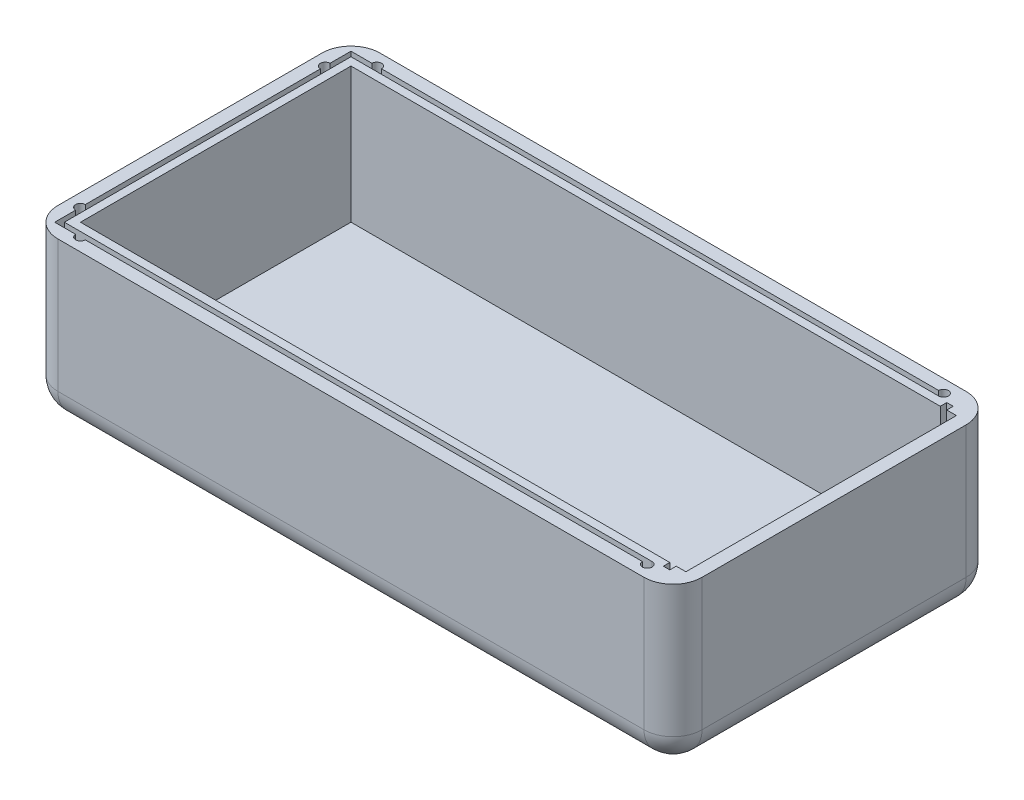
from build123d import *

# Parameters (mm, degrees)
SKETCH_1_W           = 100
SKETCH_1_H           = 50
EXTRUDE_1_DEPTH      = 25
SHELL_1_T            = -4
FILLET_1_R           = 4.5
SKETCH_2_R           = 0.75
CUT_EXTRUDE_1_DEPTH  = 5
CUT_EXTRUDE_3_DEPTH  = 2.5
SKETCH_8_W           = 36
SKETCH_8_H           = 12
CUT_EXTRUDE_4_DEPTH  = 3
SKETCH_9_W           = 42
SKETCH_9_H           = 21
CUT_EXTRUDE_7_DEPTH  = 2
SKETCH_7_W           = 1
SKETCH_7_H           = 42
CUT_EXTRUDE_8_DEPTH  = 1
SKETCH_11_W          = 1
SKETCH_11_H          = 21
CUT_EXTRUDE_10_DEPTH = 1
SKETCH_12_W          = 1
SKETCH_12_H          = 21
CUT_EXTRUDE_11_DEPTH = 1


with BuildPart() as part:
    # Эскиз1 → Бобышка-Вытянуть1 (new body)
    with BuildSketch(Plane(origin=(0, 0, 0), x_dir=(1, 0, 0), z_dir=(0, 1, 0))):
        with Locations((50, -25)):
            Rectangle(SKETCH_1_W, SKETCH_1_H)
    extrude(amount=EXTRUDE_1_DEPTH)

    # Оболочка1
    shell_1_openings = [part.faces().sort_by_distance(p)[0] for p in [
        (50, 25, 25),
    ]]
    offset(amount=SHELL_1_T, openings=shell_1_openings, kind=Kind.INTERSECTION)

    # Скругление1
    fillet_1_edges = [part.edges().sort_by_distance(p)[0] for p in [
        (50, 0, 50),
        (100, 0, 25),
        (50, 0, 0),
        (0, 0, 25),
        (100, 12.5, 0),
        (100, 12.5, 50),
        (0, 12.5, 0),
        (0, 12.5, 50),
    ]]
    fillet(fillet_1_edges, radius=FILLET_1_R)

    # Эскиз2 → Вырез-Вытянуть1 (cut)
    with BuildSketch(Plane(origin=(0, 25, 0), x_dir=(1, 0, 0), z_dir=(0, 1, 0))):
        with BuildLine():
            Line((2, -2), (2, -5.25))
            ThreePointArc((2, -5.25), (1.469669914, -6.530330086), (2.75, -6))
            Line((2.75, -6), (2.75, -2.75))
            Line((2.75, -2.75), (6, -2.75))
            ThreePointArc((6, -2.75), (6.530330086, -1.469669914), (5.25, -2))
            Line((5.25, -2), (2, -2))
        make_face()
        with BuildLine():
            Line((2, -44.75), (2, -48))
            Line((2, -48), (5.25, -48))
            ThreePointArc((5.25, -48), (6.530330086, -48.530330086), (6, -47.25))
            Line((6, -47.25), (2.75, -47.25))
            Line((2.75, -47.25), (2.75, -44))
            ThreePointArc((2.75, -44), (1.469669914, -43.469669914), (2, -44.75))
        make_face()
        with Locations((94, -2)):
            Circle(SKETCH_2_R)
        with Locations((94, -48)):
            Circle(SKETCH_2_R)
    extrude(amount=-CUT_EXTRUDE_1_DEPTH, mode=Mode.SUBTRACT)

    # Эскиз2<6> → Вырез-Вытянуть3 (cut)
    with BuildSketch(Plane(origin=(0, 25, 0), x_dir=(1, 0, 0), z_dir=(0, 1, 0))):
        with BuildLine():
            Line((2.75, -44), (2.75, -6))
            ThreePointArc((2.75, -6), (2.530330086, -6.530330086), (2, -6.75))
            Line((2, -6.75), (2, -43.25))
            ThreePointArc((2, -43.25), (2.530330086, -43.469669914), (2.75, -44))
        make_face()
        with BuildLine():
            ThreePointArc((6.75, -2), (6.530330086, -2.530330086), (6, -2.75))
            Line((6, -2.75), (94, -2.75))
            ThreePointArc((94, -2.75), (93.469669914, -2.530330086), (93.25, -2))
            Line((93.25, -2), (6.75, -2))
        make_face()
        with BuildLine():
            Line((94, -47.25), (6, -47.25))
            ThreePointArc((6, -47.25), (6.530330086, -47.469669914), (6.75, -48))
            Line((6.75, -48), (93.25, -48))
            ThreePointArc((93.25, -48), (93.469669914, -47.469669914), (94, -47.25))
        make_face()
    extrude(amount=-CUT_EXTRUDE_3_DEPTH, mode=Mode.SUBTRACT)

    # Эскиз8 → Вырез-Вытянуть4 (cut)
    with BuildSketch(Plane.ZY.offset(-96)):
        with Locations((25, 14.5)):
            Rectangle(SKETCH_8_W, SKETCH_8_H)
    extrude(amount=-CUT_EXTRUDE_4_DEPTH, mode=Mode.SUBTRACT)

    # Эскиз9 → Вырез-Вытянуть7 (cut)
    with BuildSketch(Plane.ZY.offset(-96)):
        with Locations((25, 14.5)):
            Rectangle(SKETCH_9_W, SKETCH_9_H)
    extrude(amount=-CUT_EXTRUDE_7_DEPTH, mode=Mode.SUBTRACT)

    # Эскиз7 → Вырез-Вытянуть8 (cut)
    with BuildSketch(Plane(origin=(0, 4, 0), x_dir=(1, 0, 0), z_dir=(0, 1, 0))):
        with Locations((96, -25)):
            Rectangle(SKETCH_7_W, SKETCH_7_H)
    extrude(amount=-CUT_EXTRUDE_8_DEPTH, mode=Mode.SUBTRACT)

    # Эскиз11 → Вырез-Вытянуть10 (cut)
    with BuildSketch(Plane.XY.offset(4)):
        with Locations((96, 14.5)):
            Rectangle(SKETCH_11_W, SKETCH_11_H)
    extrude(amount=-CUT_EXTRUDE_10_DEPTH, mode=Mode.SUBTRACT)

    # Эскиз12 → Вырез-Вытянуть11 (cut)
    with BuildSketch(Plane(origin=(0, 0, 46), x_dir=(-1, 0, 0), z_dir=(0, 0, -1))):
        with Locations((-96, 14.5)):
            Rectangle(SKETCH_12_W, SKETCH_12_H)
    extrude(amount=-CUT_EXTRUDE_11_DEPTH, mode=Mode.SUBTRACT)


solid = part.part
